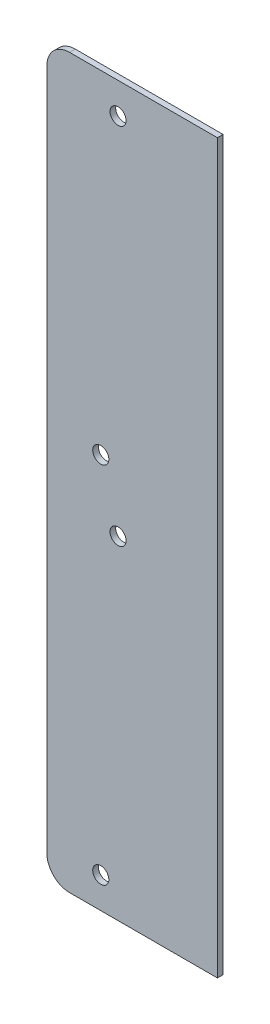
from build123d import *

# Parameters (mm, degrees)
SKETCH1_W            = 34.925
SKETCH1_H            = 101.6
BOSS_EXTRUDE1_DEPTH  = 1.5875
M4_CLEARANCE_HOLE1_D = 4.5
BOSS_EXTRUDE4_START  = -1.5875
SKETCH8_W            = 34.925
SKETCH8_H            = 101.6
SKETCH8_R            = 2.25
BOSS_EXTRUDE4_DEPTH  = 1.5875
SKETCH9_W            = 12.7
SKETCH9_H            = 203.2
BOSS_EXTRUDE5_DEPTH  = 1.5875
FILLET1_R            = 6.35


with BuildPart() as part:
    # Sketch1 → Boss-Extrude1 (new body)
    with BuildSketch(Plane.XY):
        Rectangle(SKETCH1_W, SKETCH1_H)
    extrude(amount=BOSS_EXTRUDE1_DEPTH)

    # M4 Clearance Hole1 (through all)
    with Locations(Plane.XY.offset(1.5875)):
        with Locations((-2.413, -42.164), (2.413, 42.164)):
            Hole(M4_CLEARANCE_HOLE1_D / 2)

    # Sketch8 → Boss-Extrude4 (add)
    # profile 1 of 2: a face of its own
    with BuildSketch(Plane.XY.offset(1.5875).offset(BOSS_EXTRUDE4_START)):
        with Locations((0, 101.6)):
            Rectangle(SKETCH8_W, SKETCH8_H)
        with Locations((-2.413, 59.436)):
            Circle(SKETCH8_R, mode=Mode.SUBTRACT)
        with Locations((2.413, 143.764)):
            Circle(SKETCH8_R, mode=Mode.SUBTRACT)
    # profile 2 of 2: a face of its own
    with BuildSketch(Plane.XY.offset(1.5875).offset(BOSS_EXTRUDE4_START)):
        Rectangle(SKETCH8_W, SKETCH8_H)
        with Locations((-2.413, -42.164)):
            Circle(SKETCH8_R, mode=Mode.SUBTRACT)
        with Locations((2.413, 42.164)):
            Circle(SKETCH8_R, mode=Mode.SUBTRACT)
    extrude(amount=BOSS_EXTRUDE4_DEPTH)

    # Sketch9 → Boss-Extrude5 (add)
    with BuildSketch(Plane.XY.offset(1.5875)):
        with Locations((23.8125, 50.8)):
            Rectangle(SKETCH9_W, SKETCH9_H)
    extrude(amount=-BOSS_EXTRUDE5_DEPTH)

    # Fillet1
    fillet1_edges = [part.edges().sort_by_distance(p)[0] for p in [
        (-17.4625, 152.4, 0.79375),
        (-17.4625, -50.8, 0.79375),
    ]]
    fillet(fillet1_edges, radius=FILLET1_R)


solid = part.part
